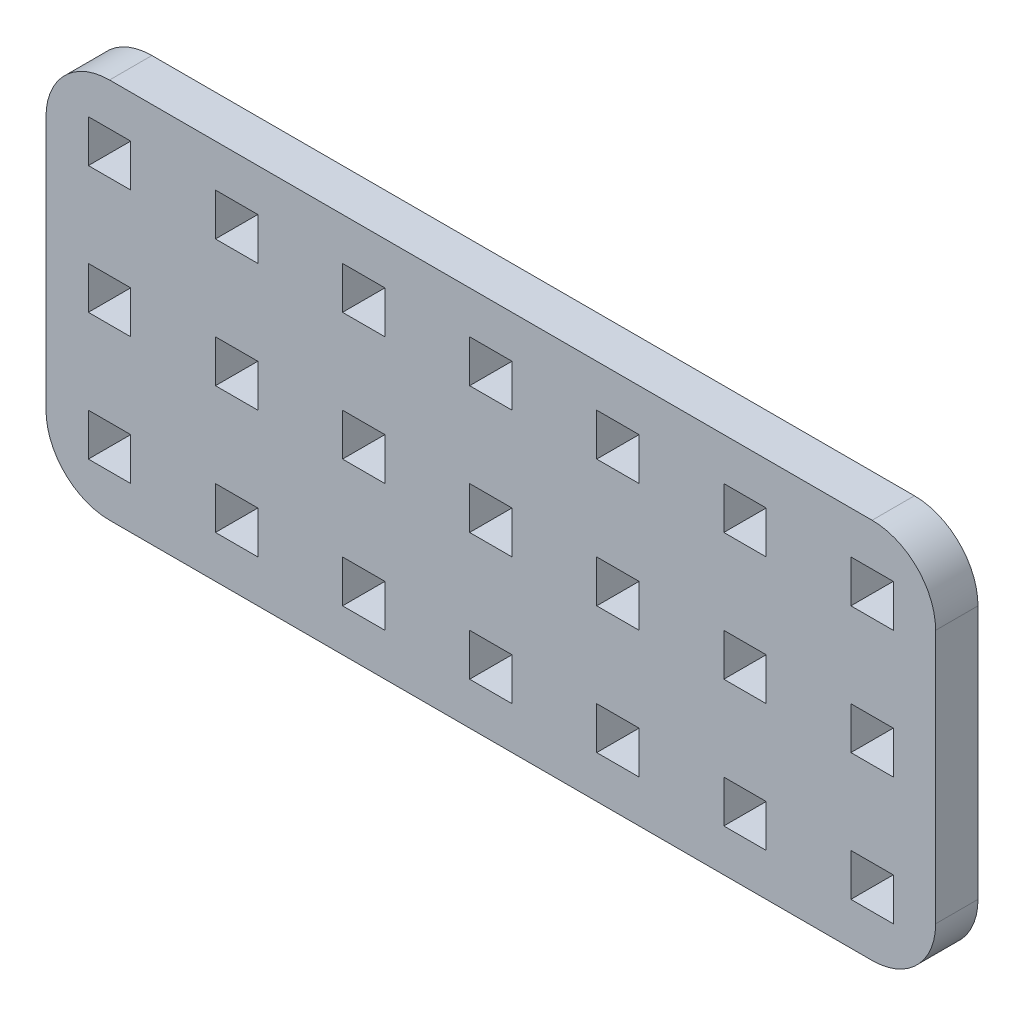
from build123d import *

# Parameters (mm, degrees)
MODEL_W                 = 3
MODEL_H                 = 3
SALIENTE_EXTRUIR1_DEPTH = 3


with BuildPart() as part:
    # Model → Saliente-Extruir1 (new body)
    with BuildSketch(Plane.XY):
        with BuildLine():
            Line((13.663940534, 300.565078072), (67.663940534, 300.565078072))
            ThreePointArc((67.663940534, 300.565078072), (70.845921049, 299.247058587), (72.163940534, 296.065078072))
            Line((72.163940534, 296.065078072), (72.163940534, 278.065078072))
            ThreePointArc((72.163940534, 278.065078072), (70.845921049, 274.883097556), (67.663940534, 273.565078072))
            Line((67.663940534, 273.565078072), (13.663940534, 273.565078072))
            ThreePointArc((13.663940534, 273.565078072), (10.481960019, 274.883097556), (9.163940534, 278.065078072))
            Line((9.163940534, 278.065078072), (9.163940534, 296.065078072))
            ThreePointArc((9.163940534, 296.065078072), (10.481960019, 299.247058587), (13.663940534, 300.565078072))
        make_face()
        with Locations((13.663940534, 296.065078072)):
            Rectangle(MODEL_W, MODEL_H, mode=Mode.SUBTRACT)
        with Locations((22.663940534, 296.065078072)):
            Rectangle(MODEL_W, MODEL_H, mode=Mode.SUBTRACT)
        with Locations((31.663940534, 296.065078072)):
            Rectangle(MODEL_W, MODEL_H, mode=Mode.SUBTRACT)
        with Locations((58.663940534, 296.065078072)):
            Rectangle(MODEL_W, MODEL_H, mode=Mode.SUBTRACT)
        with Locations((67.663940534, 296.065078072)):
            Rectangle(MODEL_W, MODEL_H, mode=Mode.SUBTRACT)
        with Locations((13.663940534, 278.065078072)):
            Rectangle(MODEL_W, MODEL_H, mode=Mode.SUBTRACT)
        with Locations((22.663940534, 278.065078072)):
            Rectangle(MODEL_W, MODEL_H, mode=Mode.SUBTRACT)
        with Locations((31.663940534, 278.065078072)):
            Rectangle(MODEL_W, MODEL_H, mode=Mode.SUBTRACT)
        with Locations((58.663940534, 278.065078072)):
            Rectangle(MODEL_W, MODEL_H, mode=Mode.SUBTRACT)
        with Locations((67.663940534, 278.065078072)):
            Rectangle(MODEL_W, MODEL_H, mode=Mode.SUBTRACT)
        with Locations((13.663940534, 287.065078072)):
            Rectangle(MODEL_W, MODEL_H, mode=Mode.SUBTRACT)
        with Locations((22.663940534, 287.065078072)):
            Rectangle(MODEL_W, MODEL_H, mode=Mode.SUBTRACT)
        with Locations((31.663940534, 287.065078072)):
            Rectangle(MODEL_W, MODEL_H, mode=Mode.SUBTRACT)
        with Locations((58.663940534, 287.065078072)):
            Rectangle(MODEL_W, MODEL_H, mode=Mode.SUBTRACT)
        with Locations((67.663940534, 287.065078072)):
            Rectangle(MODEL_W, MODEL_H, mode=Mode.SUBTRACT)
        with Locations((40.663940534, 296.065078072)):
            Rectangle(MODEL_W, MODEL_H, mode=Mode.SUBTRACT)
        with Locations((49.663940534, 296.065078072)):
            Rectangle(MODEL_W, MODEL_H, mode=Mode.SUBTRACT)
        with Locations((40.663940534, 278.065078072)):
            Rectangle(MODEL_W, MODEL_H, mode=Mode.SUBTRACT)
        with Locations((49.663940534, 278.065078072)):
            Rectangle(MODEL_W, MODEL_H, mode=Mode.SUBTRACT)
        with Locations((40.663940534, 287.065078072)):
            Rectangle(MODEL_W, MODEL_H, mode=Mode.SUBTRACT)
        with Locations((49.663940534, 287.065078072)):
            Rectangle(MODEL_W, MODEL_H, mode=Mode.SUBTRACT)
    extrude(amount=SALIENTE_EXTRUIR1_DEPTH)


solid = part.part
